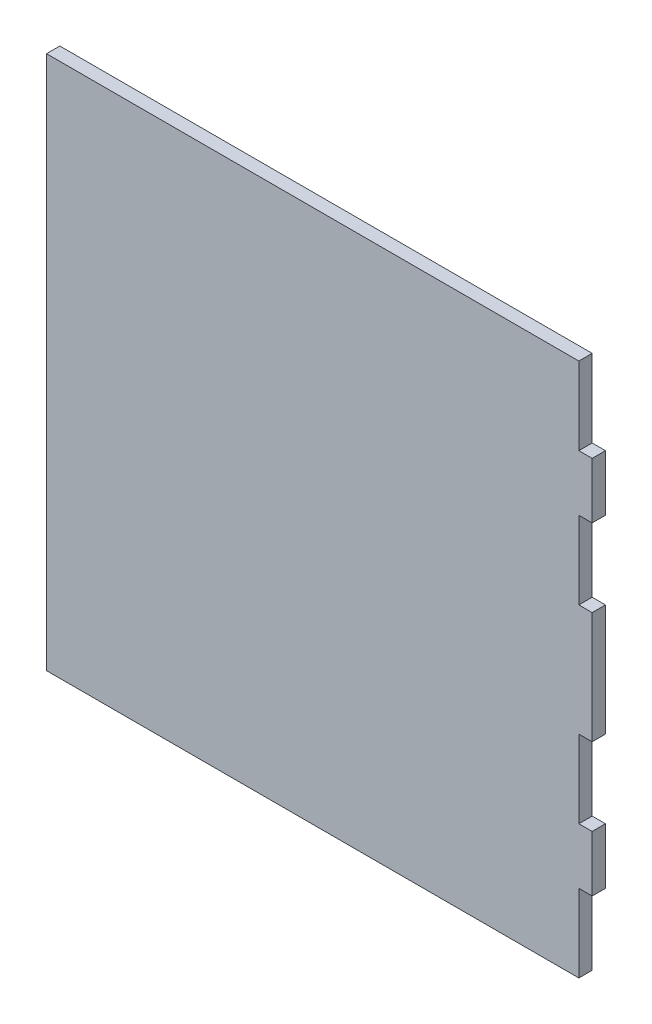
from build123d import *

# Parameters (mm, degrees)
BOSS_EXTRUDE1_DEPTH = 6


with BuildPart() as part:
    # Sketch1 → Boss-Extrude1 (new body)
    with BuildSketch(Plane.XY):
        Polygon((-163.972610893, -220.333334922), (-163.972610893, -255.333334922), (-157.972610893, -255.333334922), (-157.972610893, -305.782948582), (-163.972610893, -305.782948582), (-163.972610893, -340.782948582), (-157.972610893, -340.782948582), (-157.972610893, -366.007755411), (-163.972610893, -366.007755411), (-163.972610893, -401.007755411), (-403.972610893, -401.007755411), (-403.972610893, -160.108528092), (-163.972610893, -160.108528092), (-163.972610893, -195.108528092), (-157.972610893, -195.108528092), (-157.972610893, -220.333334922), align=None)
    extrude(amount=BOSS_EXTRUDE1_DEPTH)


solid = part.part
